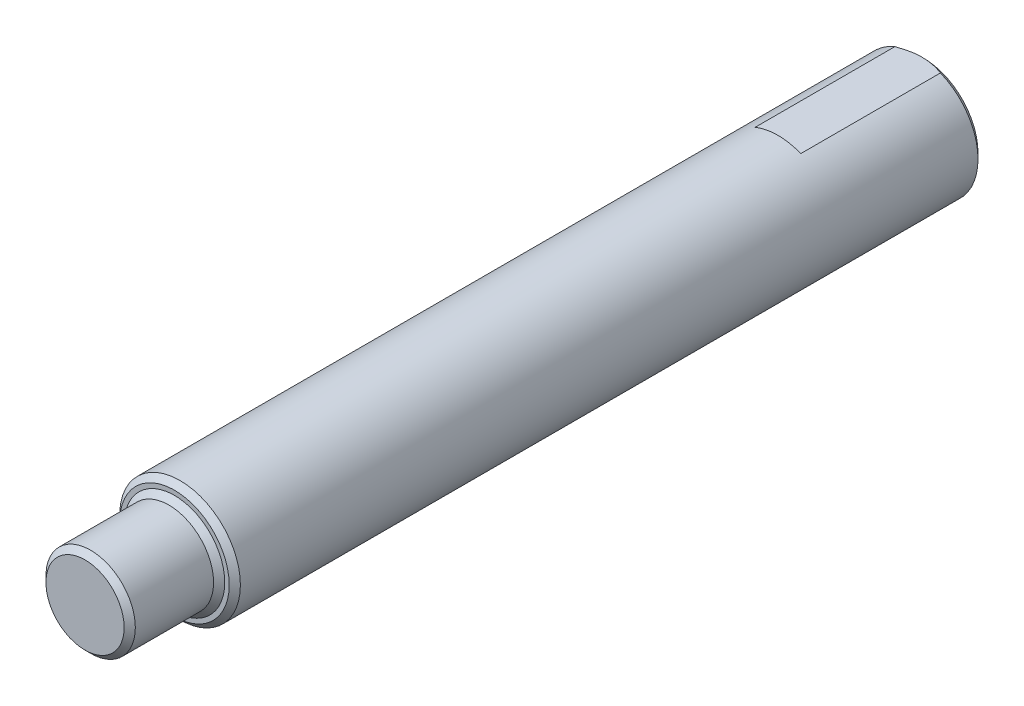
from build123d import *

# Parameters (mm, degrees)
SKETCH_1_R             = 5.4
EXTRUDE_1_DEPTH        = 67
CHAMFER_1_SIZE         = 0.5
SKETCH_2_R             = 4
EXTRUDE_2_DEPTH        = 8
CHAMFER_2_SIZE         = 0.5
HOLE_WIZARD_M5_1_D     = 4.2
HOLE_WIZARD_M5_1_DEPTH = 12.4
HOLE_WIZARD_M5_1_TIP   = 1.2618073
CHAMFER_3_SIZE         = 0.5
SKETCH_5_W             = 10
SKETCH_5_H             = 3
CUT_EXTRUDE_3_DEPTH    = 13
CHAMFER_4_SIZE         = 0.5


with BuildPart() as part:
    # 草图1 → 拉伸1 (new body)
    with BuildSketch(Plane.XY):
        Circle(SKETCH_1_R)
    extrude(amount=EXTRUDE_1_DEPTH)

    # 倒角1
    chamfer_1_edges = [part.edges().sort_by_distance(p)[0] for p in [
        (-5.4, 0, 0),
        (-5.4, 0, 67),
    ]]
    chamfer(chamfer_1_edges, length=CHAMFER_1_SIZE)

    # 草图2 → 拉伸2 (add)
    with BuildSketch(Plane.XY.offset(67)):
        Circle(SKETCH_2_R)
    extrude(amount=EXTRUDE_2_DEPTH)

    # 倒角2
    chamfer_2_edges = [part.edges().sort_by_distance(p)[0] for p in [
        (-4, 0, 75),
    ]]
    chamfer(chamfer_2_edges, length=CHAMFER_2_SIZE)

    # M5 螺纹孔1
    with Locations(Plane(origin=(0, 0, 0), x_dir=(-1, 0, 0), z_dir=(0, 0, -1))):
        with Locations((0, 0)):
            Hole(HOLE_WIZARD_M5_1_D / 2, depth=HOLE_WIZARD_M5_1_DEPTH)
            with Locations((0, 0, -(HOLE_WIZARD_M5_1_DEPTH + HOLE_WIZARD_M5_1_TIP / 2))):  # 118° drill point
                Cone(0, HOLE_WIZARD_M5_1_D / 2, HOLE_WIZARD_M5_1_TIP, mode=Mode.SUBTRACT)

    # 倒角3
    chamfer_3_edges = [part.edges().sort_by_distance(p)[0] for p in [
        (-2.1, 0, 0),
    ]]
    chamfer(chamfer_3_edges, length=CHAMFER_3_SIZE)

    # 草图5 → 拉伸3 (cut)
    with BuildSketch(Plane.XY):
        with Locations((0, 6.5)):
            Rectangle(SKETCH_5_W, SKETCH_5_H)
    cut_extrude_3 = extrude(amount=CUT_EXTRUDE_3_DEPTH, mode=Mode.SUBTRACT)

    # 镜向1: 拉伸3 across plane
    add(cut_extrude_3.mirror(Plane.ZX), mode=Mode.SUBTRACT)

    # 倒角4
    chamfer_4_edges = [part.edges().sort_by_distance(p)[0] for p in [
        (-4, 0, 67),
    ]]
    chamfer(chamfer_4_edges, length=CHAMFER_4_SIZE)


solid = part.part
